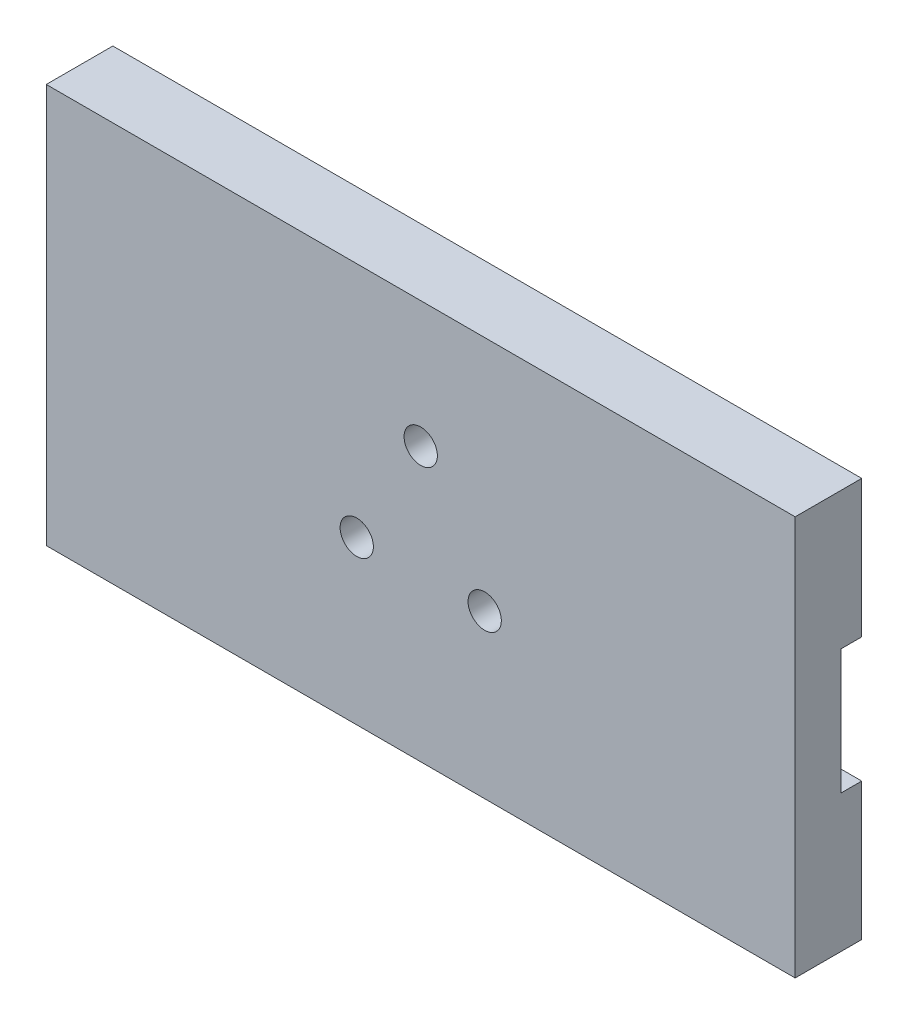
from build123d import *

# Parameters (mm, degrees)
SKETCH_1_W               = 90
SKETCH_1_H               = 48
EXTRUDE_1_DEPTH          = 8
SKETCH_6_R               = 1.8
CUT_EXTRUDE_4_DEPTH      = 3
MIRROR_6_COPY_1_SKETCH_R = 1.8
MIRROR_6_COPY_1_DEPTH    = 3
SKETCH_7_W               = 16
SKETCH_7_H               = 15
CUT_EXTRUDE_5_DEPTH      = 2.5
SKETCH_4_R               = 2
CUT_EXTRUDE_6_DEPTH      = 10
PATTERN_CIRCULAR_1_COUNT = 3


with BuildPart() as part:
    # 草图1 → 凸台-拉伸1 (new body)
    with BuildSketch(Plane.XY):
        Rectangle(SKETCH_1_W, SKETCH_1_H)
    extrude(amount=EXTRUDE_1_DEPTH)

    # 草图6 → 切除-拉伸4 (cut)
    with BuildSketch(Plane(origin=(0, 0, 0), x_dir=(-1, 0, 0), z_dir=(0, 0, -1))):
        with Locations((-41, 21)):
            Circle(SKETCH_6_R)
    cut_extrude_4 = extrude(amount=-CUT_EXTRUDE_4_DEPTH, mode=Mode.SUBTRACT)

    # 镜向5: 切除-拉伸4 across plane
    add(cut_extrude_4.mirror(Plane.ZX), mode=Mode.SUBTRACT)

    # 镜向6: 切除-拉伸4 across plane
    add(cut_extrude_4.mirror(Plane(origin=(0, 0, 0), x_dir=(0, 0, 1), z_dir=(1, 0, 0))), mode=Mode.SUBTRACT)

    # 镜向6 copy 1 sketch → 镜向6 copy 1 (cut)
    with BuildSketch(Plane(origin=(0, 0, 0), x_dir=(1, 0, 0), z_dir=(0, 0, -1))):
        with Locations((-41, 21)):
            Circle(MIRROR_6_COPY_1_SKETCH_R)
    extrude(amount=-MIRROR_6_COPY_1_DEPTH, mode=Mode.SUBTRACT)

    # 草图7 → 切除-拉伸5 (cut)
    with BuildSketch(Plane(origin=(0, 0, 0), x_dir=(-1, 0, 0), z_dir=(0, 0, -1))):
        with Locations((-45.051826461, 0)):
            Rectangle(SKETCH_7_W, SKETCH_7_H)
    cut_extrude_5 = extrude(amount=-CUT_EXTRUDE_5_DEPTH, mode=Mode.SUBTRACT)

    # 镜向7: 切除-拉伸5 across plane
    add(cut_extrude_5.mirror(Plane(origin=(0, 0, 0), x_dir=(0, 0, 1), z_dir=(1, 0, 0))), mode=Mode.SUBTRACT)

    # 草图4 → 切除-拉伸6 (cut)
    with BuildSketch(Plane.XY.offset(8)):
        with Locations((0, 8.85)):
            Circle(SKETCH_4_R)
    cut_extrude_6 = extrude(amount=-CUT_EXTRUDE_6_DEPTH, mode=Mode.SUBTRACT)

    # 阵列(圆周)1: 切除-拉伸6 ×3 about axis
    pattern_circular_1_axis = Axis((0, -0.027607952, 0), (0, 0, 1))
    for i in range(1, PATTERN_CIRCULAR_1_COUNT):
        add(cut_extrude_6.rotate(pattern_circular_1_axis, i * 360 / PATTERN_CIRCULAR_1_COUNT), mode=Mode.SUBTRACT)


solid = part.part
